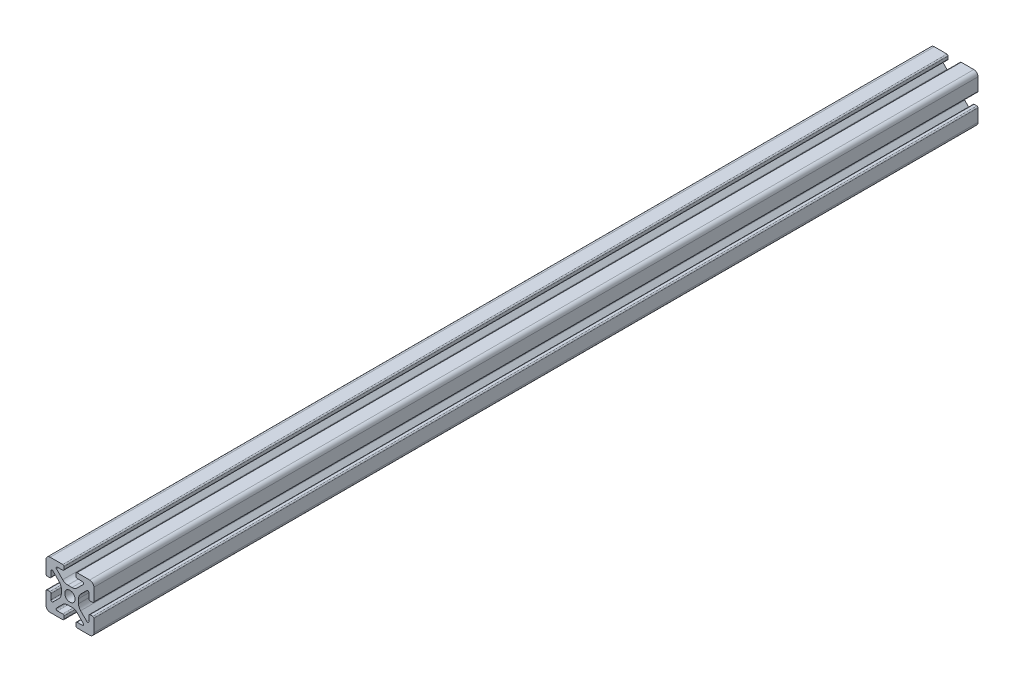
from build123d import *

# Parameters (mm, degrees)
BOSS_EXTRUDE1_DEPTH = 304.8
SKETCH5_W           = 26.995197012
SKETCH5_H           = 24.68705749
CUT_EXTRUDE1_DEPTH  = 240.025


with BuildPart() as part:
    # Sketch4 → Boss-Extrude1 (new, symmetric)
    with BuildSketch(Plane.XY):
        with BuildLine():
            Line((3, -10), (8.25, -10))
            ThreePointArc((8.25, -10), (9.487436867, -9.487436867), (10, -8.25))
            Line((10, -8.25), (10, -3))
            ThreePointArc((10, -3), (9.853553391, -2.646446609), (9.5, -2.5))
            Line((9.5, -2.5), (8.424621202, -2.5))
            ThreePointArc((8.424621202, -2.5), (8.071067812, -2.646446609), (7.924621202, -3))
            Line((7.924621202, -3), (7.924621202, -5.25))
            ThreePointArc((7.924621202, -5.25), (7.615962919, -5.711939766), (7.071067812, -5.603553391))
            Line((7.071067812, -5.603553391), (4.478679656, -3.011165235))
            ThreePointArc((4.478679656, -3.011165235), (3.828361402, -2.037895189), (3.6, -0.889844892))
            Line((3.6, -0.889844892), (3.6, 0))
            Line((3.6, 0), (2.15, 0))
            ThreePointArc((2.15, 0), (1.52027958, -1.52027958), (0, -2.15))
            Line((0, -2.15), (0, -3.6))
            Line((0, -3.6), (0.889844892, -3.6))
            ThreePointArc((0.889844892, -3.6), (2.037895189, -3.828361402), (3.011165235, -4.478679656))
            Line((3.011165235, -4.478679656), (5.603553391, -7.071067812))
            ThreePointArc((5.603553391, -7.071067812), (5.711939766, -7.615962919), (5.25, -7.924621202))
            Line((5.25, -7.924621202), (3, -7.924621202))
            ThreePointArc((3, -7.924621202), (2.646446609, -8.071067812), (2.5, -8.424621202))
            Line((2.5, -8.424621202), (2.5, -9.5))
            ThreePointArc((2.5, -9.5), (2.646446609, -9.853553391), (3, -10))
        make_face()
    extrude(amount=BOSS_EXTRUDE1_DEPTH, both=True)

    # Mirror1: part across plane


with BuildPart() as part_1:
    add(part.part)
    add(part.part.mirror(Plane(origin=(0, 0, 0), x_dir=(0, 0, 1), z_dir=(1, 0, 0))))

    # Mirror2: part across plane


with BuildPart() as part_2:
    add(part_1.part)
    add(part_1.part.mirror(Plane.ZX))

    # Sketch5 → Cut-Extrude1 (cut)
    with BuildSketch(Plane(origin=(0, 0, -304.8), x_dir=(-1, 0, 0), z_dir=(0, 0, -1))):
        with Locations((-0.333544011, -0.025224209)):
            Rectangle(SKETCH5_W, SKETCH5_H)
    extrude(amount=-CUT_EXTRUDE1_DEPTH, mode=Mode.SUBTRACT)


solid = part_2.part
